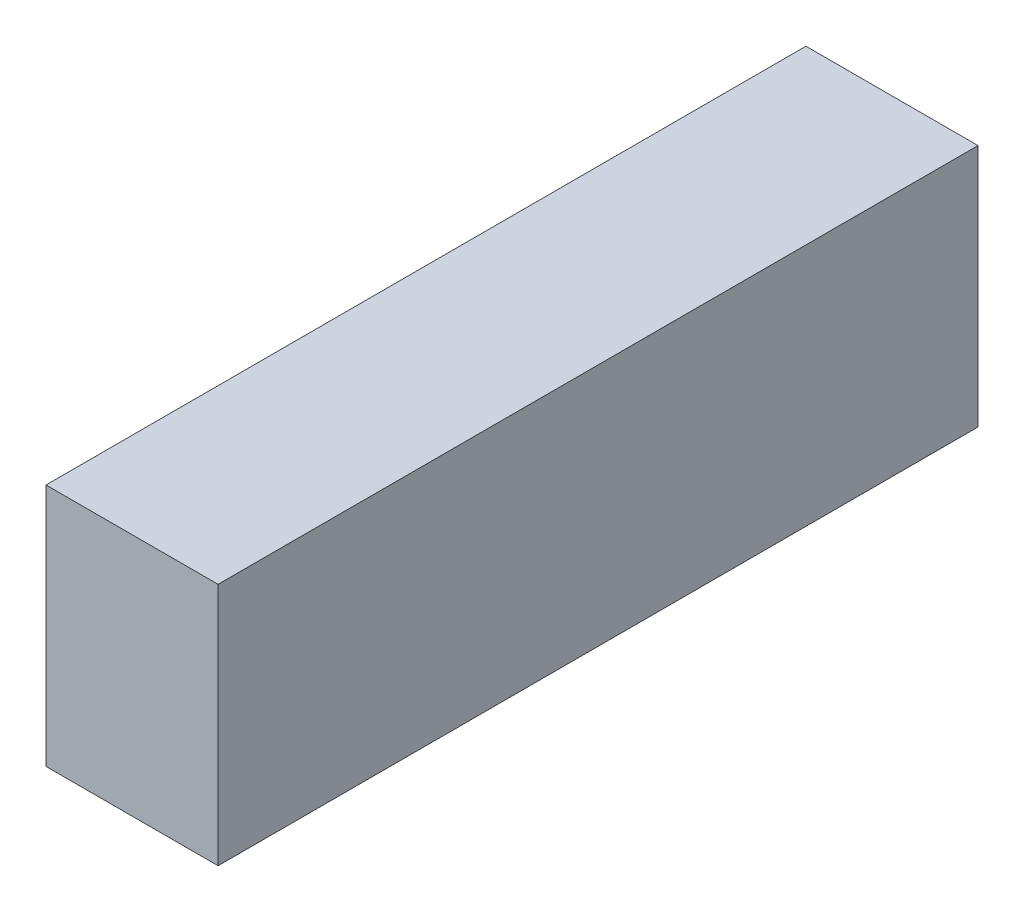
from build123d import *

# Parameters (mm, degrees)
CASE_SKETCH_W = 106
CASE_SKETCH_H = 34
CASE_2_DEPTH  = 24


with BuildPart() as part:
    # Case Sketch → Case 2 (new body)
    with BuildSketch(Plane(origin=(0, 0, 0), x_dir=(0, 0, -1), z_dir=(1, 0, 0))):
        with Locations((0, 25)):
            Rectangle(CASE_SKETCH_W, CASE_SKETCH_H)
    extrude(amount=-CASE_2_DEPTH)


solid = part.part
